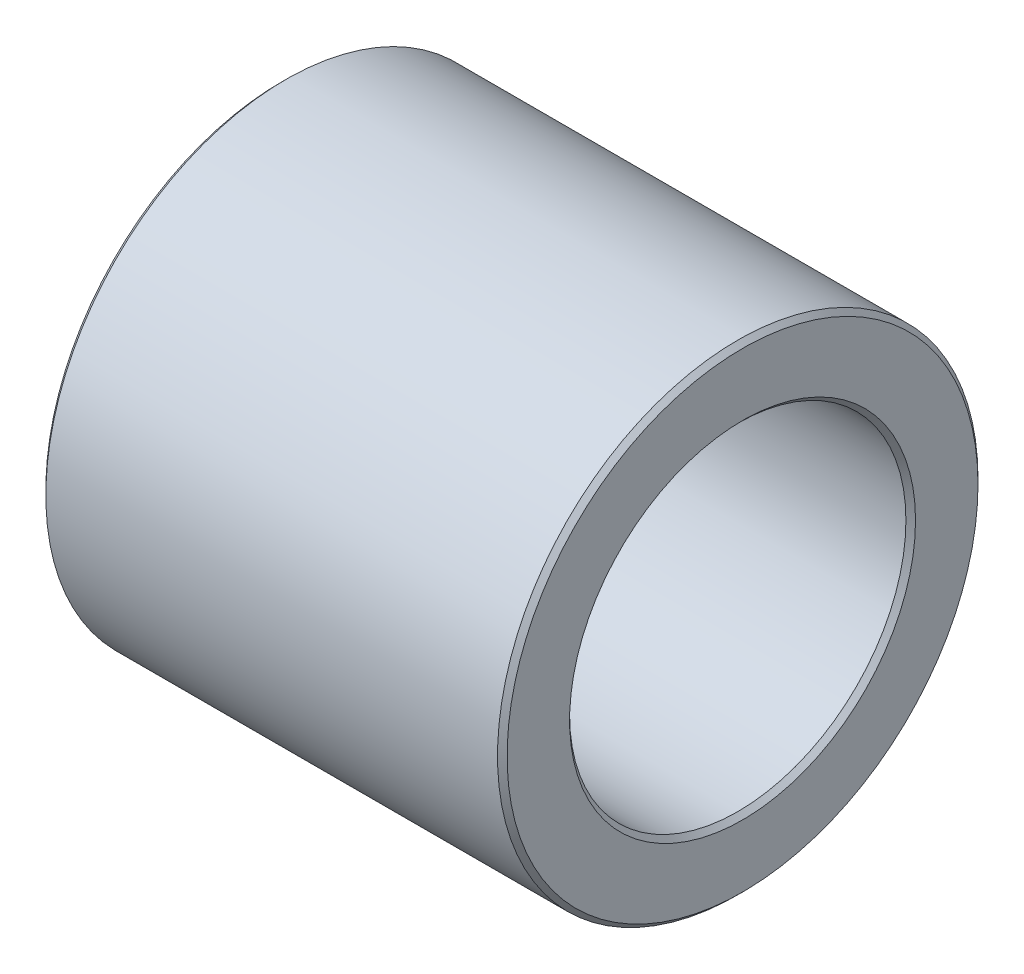
from build123d import *

# Parameters (mm, degrees)
SKETCH_1_R      = 50
SKETCH_1_R_2    = 35
EXTRUDE_1_DEPTH = 96
CHAMFER_1_SIZE  = 1


with BuildPart() as part:
    # 草图1 → 凸台-拉伸1 (new body)
    with BuildSketch(Plane(origin=(0, 0, 0), x_dir=(0, 0, -1), z_dir=(1, 0, 0))):
        Circle(SKETCH_1_R)
        Circle(SKETCH_1_R_2, mode=Mode.SUBTRACT)
    extrude(amount=EXTRUDE_1_DEPTH)

    # 倒角1
    chamfer_1_edges = [part.edges().sort_by_distance(p)[0] for p in [
        (0, 0, 50),
        (96, 0, 50),
        (0, 0, 35),
        (96, 0, 35),
    ]]
    chamfer(chamfer_1_edges, length=CHAMFER_1_SIZE)


solid = part.part
